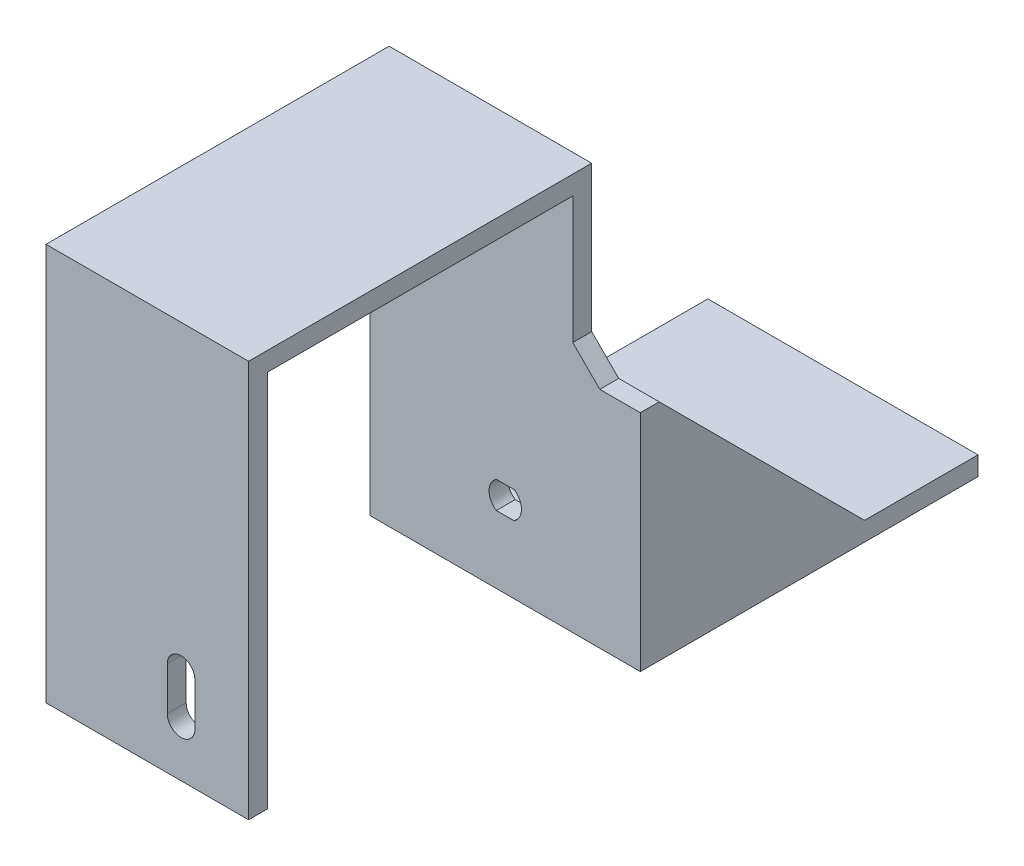
from build123d import *

# Parameters (mm, degrees)
SKETCH3_W           = 100
SKETCH3_H           = 7
BOSS_EXTRUDE3_DEPTH = 125
SKETCH4_W           = 100
SKETCH4_H           = 7
BOSS_EXTRUDE4_DEPTH = 140
CUT_EXTRUDE2_REACH  = 202.271
BOSS_EXTRUDE5_DEPTH = 7
BOSS_EXTRUDE6_DEPTH = 7
SKETCH8_W           = 100
SKETCH8_H           = 7
BOSS_EXTRUDE7_DEPTH = 120
SKETCH9_W           = 100
SKETCH9_H           = 7
BOSS_EXTRUDE8_DEPTH = 140
CUT_EXTRUDE3_REACH  = 292.703
SKETCH13_W          = 25
SKETCH13_H          = 64
CUT_EXTRUDE4_DEPTH  = 202.525034925
CHAMFER1_SIZE       = 10
CUT_EXTRUDE5_REACH  = 292.703
SKETCH15_W          = 25
SKETCH15_H          = 83


with BuildPart() as part:
    # Sketch3 → Boss-Extrude3 (new body)
    with BuildSketch(Plane.XY):
        with Locations((-3.612868806, 3.5)):
            Rectangle(SKETCH3_W, SKETCH3_H)
    extrude(amount=BOSS_EXTRUDE3_DEPTH)

    # Sketch4 → Boss-Extrude4 (add)
    with BuildSketch(Plane(origin=(0, 7, 0), x_dir=(1, 0, 0), z_dir=(0, 1, 0))):
        with Locations((-3.612868806, -121.5)):
            Rectangle(SKETCH4_W, SKETCH4_H)
    extrude(amount=BOSS_EXTRUDE4_DEPTH)

    # Sketch5 → Cut-Extrude2 (cut, up to next)
    with BuildSketch(Plane.XY.offset(125), mode=Mode.PRIVATE) as cut_extrude2_sk1:
        with BuildLine():
            ThreePointArc((2.387131194, 30), (1.673895268, 32.837274331), (-0.296244016, 35))
            Line((-0.296244016, 35), (-6.929493596, 35))
            ThreePointArc((-6.929493596, 35), (-9.612868806, 30), (-6.929493596, 25))
            Line((-6.929493596, 25), (-0.296244016, 25))
            ThreePointArc((-0.296244016, 25), (1.673895268, 27.162725669), (2.387131194, 30))
        make_face()
    cut_extrude2_tool1 = extrude(cut_extrude2_sk1.sketch, amount=-CUT_EXTRUDE2_REACH, mode=Mode.PRIVATE) & part.part
    add(cut_extrude2_tool1.solids().sort_by_distance((-3.612869, 30, 125))[0], mode=Mode.SUBTRACT)

    # Sketch6 → Boss-Extrude5 (add)
    with BuildSketch(Plane.ZY.offset(53.612868806)):
        Polygon((125, 0), (125, 90), (35, 0), align=None)
    extrude(amount=-BOSS_EXTRUDE5_DEPTH)

    # Sketch7 → Boss-Extrude6 (add)
    with BuildSketch(Plane(origin=(46.387131194, 0, 0), x_dir=(0, 0, -1), z_dir=(1, 0, 0))):
        Polygon((-125, 0), (-125, 90), (-35, 0), align=None)
    extrude(amount=-BOSS_EXTRUDE6_DEPTH)

    # Sketch8 → Boss-Extrude7 (add)
    with BuildSketch(Plane.XY.offset(125)):
        with Locations((-3.612868806, 143.5)):
            Rectangle(SKETCH8_W, SKETCH8_H)
    extrude(amount=BOSS_EXTRUDE7_DEPTH)

    # Sketch9 → Boss-Extrude8 (add)
    with BuildSketch(Plane.XZ.offset(-140)):
        with Locations((-3.612868806, 241.5)):
            Rectangle(SKETCH9_W, SKETCH9_H)
    extrude(amount=BOSS_EXTRUDE8_DEPTH)

    # Sketch10 → Cut-Extrude3 (cut, up to next)
    with BuildSketch(Plane.XY.offset(245), mode=Mode.PRIVATE) as cut_extrude3_sk1:
        with BuildLine():
            Line((-8.716428721, 35), (-8.716428721, 19))
            ThreePointArc((-8.716428721, 19), (-3.612868806, 13.896440085), (1.490691109, 19))
            Line((1.490691109, 19), (1.490691109, 35))
            ThreePointArc((1.490691109, 35), (-3.612868806, 40.103559915), (-8.716428721, 35))
        make_face()
    cut_extrude3_tool1 = extrude(cut_extrude3_sk1.sketch, amount=-CUT_EXTRUDE3_REACH, mode=Mode.PRIVATE) & part.part
    add(cut_extrude3_tool1.solids().sort_by_distance((-3.612869, 27, 245))[0], mode=Mode.SUBTRACT)

    # Sketch13 → Cut-Extrude4 (cut, through all)
    with BuildSketch(Plane(origin=(0, 0, 118), x_dir=(-1, 0, 0), z_dir=(0, 0, -1))):
        with Locations((-33.887131194, 115)):
            Rectangle(SKETCH13_W, SKETCH13_H)
    extrude(amount=-CUT_EXTRUDE4_DEPTH, mode=Mode.SUBTRACT)

    # Chamfer1
    chamfer1_edges = [part.edges().sort_by_distance(p)[0] for p in [
        (21.387131194, 83, 121.5),
    ]]
    chamfer(chamfer1_edges, length=CHAMFER1_SIZE)

    # Sketch15 → Cut-Extrude5 (cut, up to next)
    with BuildSketch(Plane.XY.offset(245), mode=Mode.PRIVATE) as cut_extrude5_sk1:
        with Locations((33.887131194, 41.5)):
            Rectangle(SKETCH15_W, SKETCH15_H)
    cut_extrude5_tool1 = extrude(cut_extrude5_sk1.sketch, amount=-CUT_EXTRUDE5_REACH, mode=Mode.PRIVATE) & part.part
    add(cut_extrude5_tool1.solids().sort_by_distance((33.887131, 41.5, 245))[0], mode=Mode.SUBTRACT)


solid = part.part
